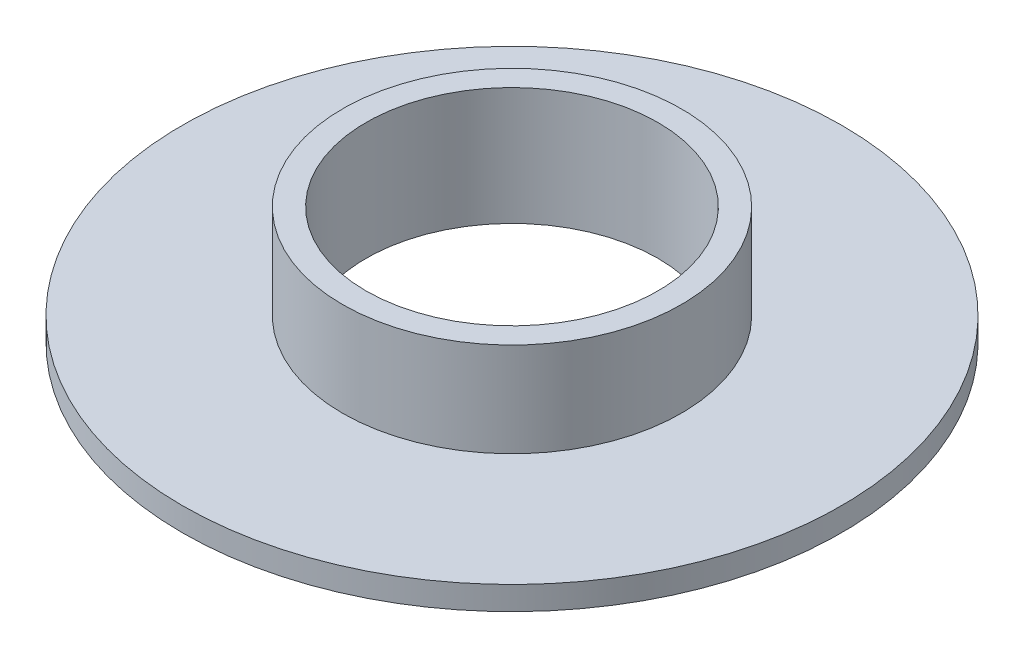
from build123d import *

# Parameters (mm, degrees)
CUT_EXTRUDE1_START = -10
SKETCH3_R          = 31
CUT_EXTRUDE1_DEPTH = 10


with BuildPart() as part:
    # Sketch1 → Revolve1 (revolve)
    with BuildSketch(Plane(origin=(0, 0, 0), x_dir=(0, 0, -1), z_dir=(1, 0, 0)), mode=Mode.PRIVATE) as revolve1_sk:
        Polygon((0, 0), (70, 0), (70, 5), (36, 5), (36, 25), (31, 25), (31, 5), (0, 5), align=None)
    revolve(revolve1_sk.sketch.rotate(Axis((0, 5, 0), (0, -1, 0)), 180), axis=Axis((0, 5, 0), (0, -1, 0)))

    # Sketch3 → Cut-Extrude1 (cut)
    with BuildSketch(Plane(origin=(0, 5, 0), x_dir=(1, 0, 0), z_dir=(0, 1, 0)).offset(CUT_EXTRUDE1_START)):
        with Locations(Location((0, 0, 0), (0, 0, 270))):
            Circle(SKETCH3_R)
    extrude(amount=CUT_EXTRUDE1_DEPTH, mode=Mode.SUBTRACT)


solid = part.part
